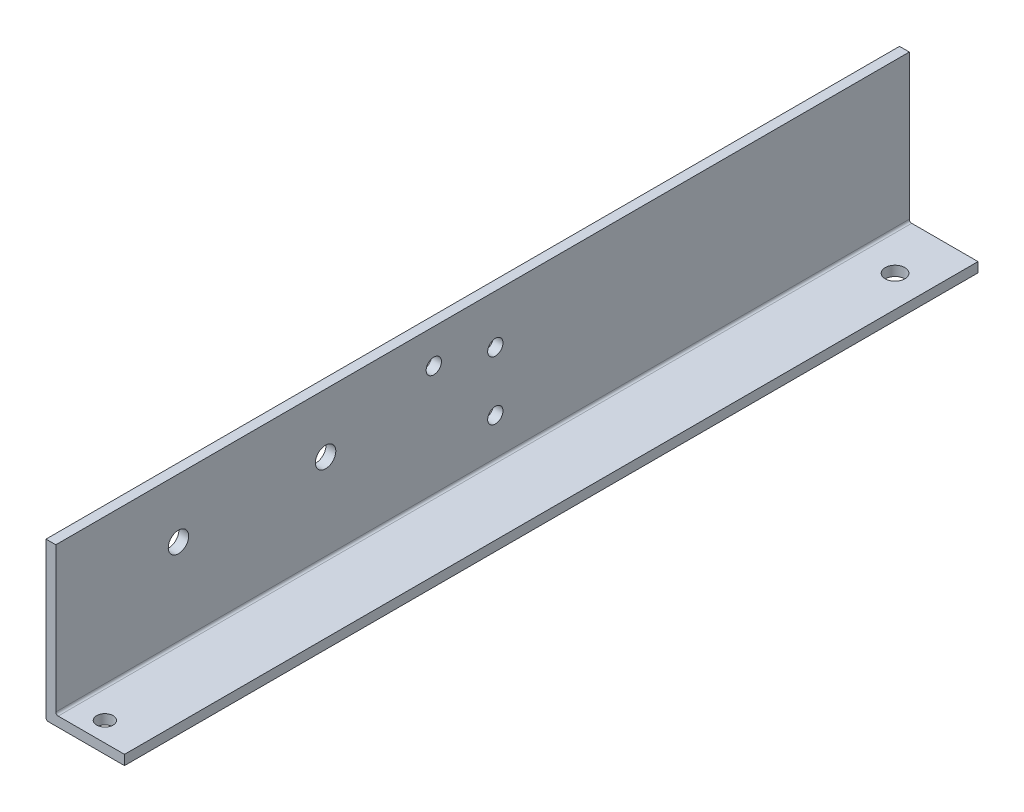
from build123d import *

# Parameters (mm, degrees)
BOSS_EXTRUDE1_DEPTH = 276.225
SKETCH3_R           = 2.667
CUT_EXTRUDE2_DEPTH  = 3.175
SKETCH4_R           = 3.302
SKETCH4_R_2         = 2.4765
CUT_EXTRUDE3_DEPTH  = 3.175
SKETCH8_R           = 2.4765
CUT_EXTRUDE5_DEPTH  = 3.175
SKETCH9_R           = 3.175
CUT_EXTRUDE6_DEPTH  = 3.175


with BuildPart() as part:
    # Sketch1 → Boss-Extrude1 (new body)
    with BuildSketch(Plane.XY):
        with BuildLine():
            Line((3.175, 50.8), (3.175, 3.937))
            ThreePointArc((3.175, 3.937), (3.398184633, 3.398184633), (3.937, 3.175))
            Line((3.937, 3.175), (25.4, 3.175))
            Line((25.4, 3.175), (25.4, 0))
            Line((25.4, 0), (0.762, 0))
            ThreePointArc((0.762, 0), (0.223184633, 0.223184633), (0, 0.762))
            Line((0, 0.762), (0, 50.8))
            Line((0, 50.8), (3.175, 50.8))
        make_face()
    extrude(amount=BOSS_EXTRUDE1_DEPTH)

    # Sketch3 → Cut-Extrude2 (cut)
    with BuildSketch(Plane.XZ):
        with Locations(Location((12.7, 269.875, 0), (0, 0, 270))):
            Circle(SKETCH3_R)
    extrude(amount=-CUT_EXTRUDE2_DEPTH, mode=Mode.SUBTRACT)

    # Sketch4 → Cut-Extrude3 (cut)
    with BuildSketch(Plane(origin=(3.175, 0, 0), x_dir=(0, 0, -1), z_dir=(1, 0, 0))):
        with Locations(Location((-188.9125, 31.75, 0), (0, 0, 90))):
            Circle(SKETCH4_R)
        with Locations(Location((-236.5375, 31.75, 0), (0, 0, 90))):
            Circle(SKETCH4_R)
        with Locations(Location((-133.985, 16.002, 0), (0, 0, 90))):
            Circle(SKETCH4_R_2)
        with Locations(Location((-133.985, 35.052, 0), (0, 0, 90))):
            Circle(SKETCH4_R_2)
    extrude(amount=-CUT_EXTRUDE3_DEPTH, mode=Mode.SUBTRACT)

    # Sketch8 → Cut-Extrude5 (cut)
    with BuildSketch(Plane.ZY):
        with Locations((153.898092, 39.759636)):
            Circle(SKETCH8_R)
    extrude(amount=-CUT_EXTRUDE5_DEPTH, mode=Mode.SUBTRACT)

    # Sketch9 → Cut-Extrude6 (cut)
    with BuildSketch(Plane(origin=(0, 3.175, 0), x_dir=(1, 0, 0), z_dir=(0, 1, 0))):
        with Locations(Location((15.24, -16.686276, 0), (0, 0, 270))):
            Circle(SKETCH9_R)
    extrude(amount=-CUT_EXTRUDE6_DEPTH, mode=Mode.SUBTRACT)


solid = part.part
